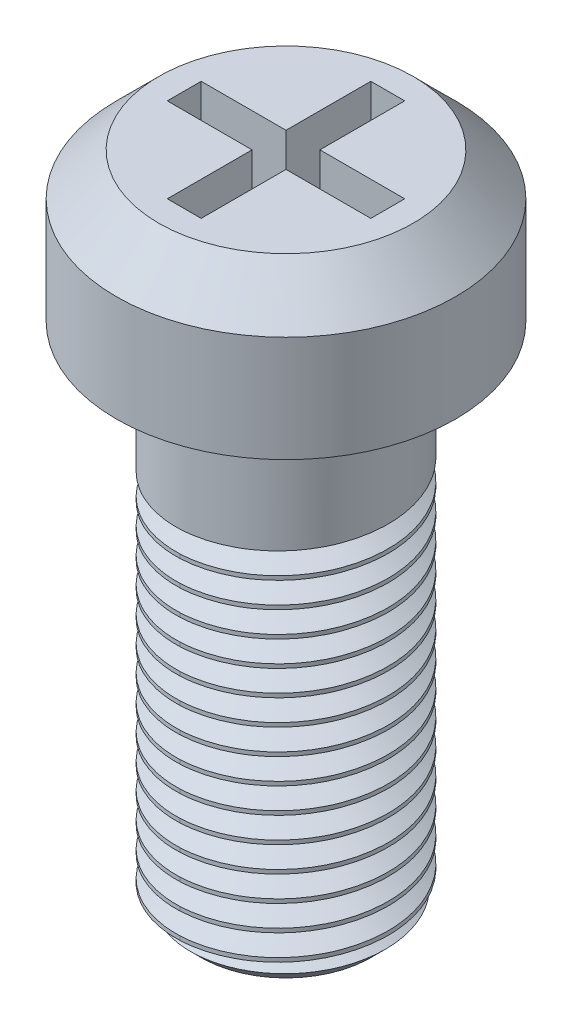
from build123d import *

# Parameters (mm, degrees)
SKETCH1_R              = 2
BOSS_EXTRUDE1_DEPTH    = 1.75
SKETCH2_R              = 1.25
BOSS_EXTRUDE2_DEPTH    = 6
CUT_EXTRUDE1_DEPTH     = 1
CHAMFER1_SIZE          = 0.5
CHAMFER2_SIZE          = 0.25
CUT_SWEEP1_PITCH       = 0.3
CUT_SWEEP1_HEIGHT      = 4.5
CUT_SWEEP1_RADIUS      = 1.25
CUT_SWEEP1_START_ANGLE = -90


with BuildPart() as part:
    # Sketch1 → Boss-Extrude1 (new body)
    with BuildSketch(Plane(origin=(0, 0, 0), x_dir=(1, 0, 0), z_dir=(0, 1, 0))):
        with Locations(Location((0, 0, 0), (0, 0, 270))):
            Circle(SKETCH1_R)
    extrude(amount=BOSS_EXTRUDE1_DEPTH)

    # Sketch2 → Boss-Extrude2 (add)
    with BuildSketch(Plane(origin=(0, 0, 0), x_dir=(-1, 0, 0), z_dir=(0, -1, 0))):
        with Locations(Location((0, 0, 0), (0, 0, 270))):
            Circle(SKETCH2_R)
    extrude(amount=BOSS_EXTRUDE2_DEPTH)

    # Sketch3 → Cut-Extrude1 (cut)
    with BuildSketch(Plane(origin=(0, 1.75, 0), x_dir=(1, 0, 0), z_dir=(0, 1, 0))):
        Polygon((-0.2, 1.2), (-0.2, 0.2), (-1.2, 0.2), (-1.2, -0.2), (-0.2, -0.2), (-0.2, -1.2), (0.2, -1.2), (0.2, -0.2), (1.2, -0.2), (1.2, 0.2), (0.2, 0.2), (0.2, 1.2), align=None)
    extrude(amount=-CUT_EXTRUDE1_DEPTH, mode=Mode.SUBTRACT)

    # Chamfer1
    chamfer1_edges = [part.edges().sort_by_distance(p)[0] for p in [
        (0, 1.75, -2),
    ]]
    chamfer(chamfer1_edges, length=CHAMFER1_SIZE)

    # Chamfer2
    chamfer2_edges = [part.edges().sort_by_distance(p)[0] for p in [
        (0, -6, -1.25),
    ]]
    chamfer(chamfer2_edges, length=CHAMFER2_SIZE)

    # Cut-Sweep1: sweep along a helix
    with BuildLine() as cut_sweep1_path:
        add(Helix(CUT_SWEEP1_PITCH, CUT_SWEEP1_HEIGHT, CUT_SWEEP1_RADIUS, center=(0, -6, 0), direction=(0, 1, 0), mode=Mode.PRIVATE).rotate(Axis((0, -6, 0), (0, 1, 0)), CUT_SWEEP1_START_ANGLE))
    # Sketch8 → Cut-Sweep1 (sweep, cut)
    with BuildSketch(Plane.XY):
        Polygon((1.031158193, -5.744652146), (1.476455311, -6.012440265), (1.485718066, -5.492907589), align=None)
    sweep(path=cut_sweep1_path.line, is_frenet=True, mode=Mode.SUBTRACT)


solid = part.part
